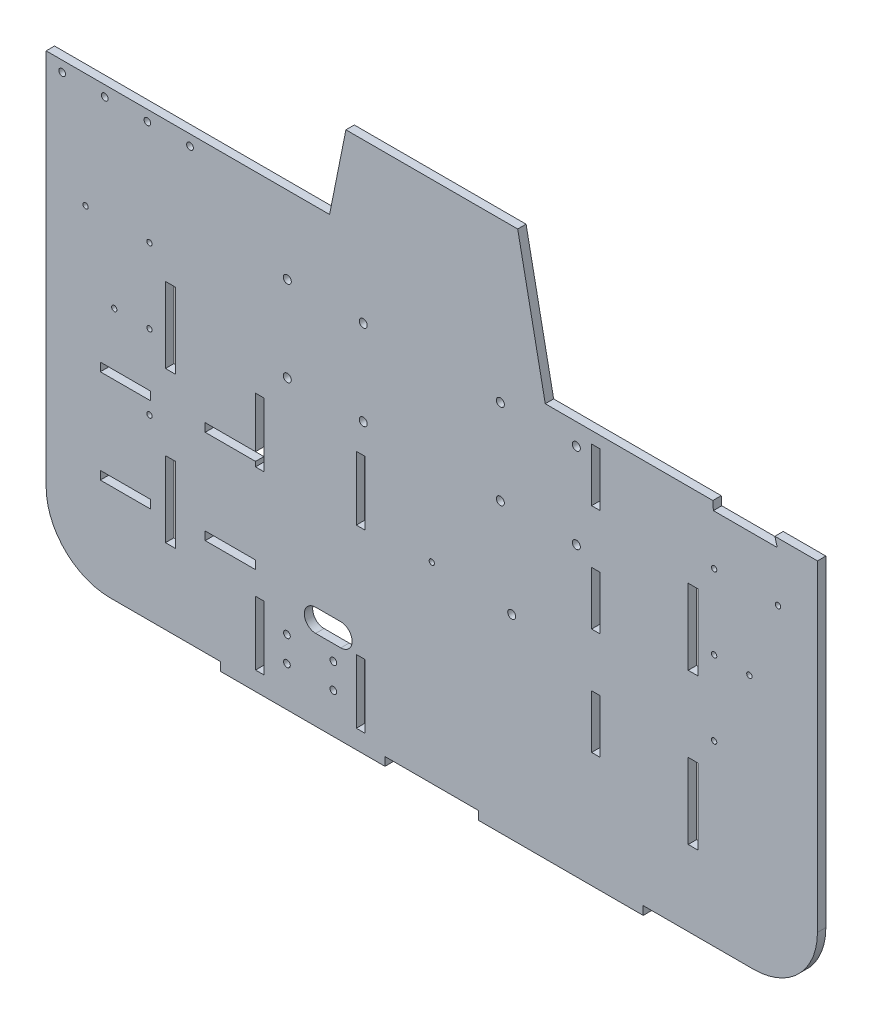
from build123d import *

# Parameters (mm, degrees)
SKETCH2_W           = 60
SKETCH2_H           = 10
SKETCH2_W_2         = 11.850089675
SKETCH2_H_2         = 89.916
SKETCH2_R           = 4
SKETCH2_W_3         = 10.16
SKETCH2_H_3         = 76.2
SKETCH2_R_2         = 3.175
SKETCH2_R_3         = 4.7625
SKETCH2_H_4         = 63.685061478
SKETCH2_H_5         = 63.685061479
BOSS_EXTRUDE1_DEPTH = 10


with BuildPart() as part:
    # Sketch2 → Boss-Extrude1 (new body)
    with BuildSketch(Plane.XY):
        with BuildLine():
            Line((-102.394461083, 316.728644457), (-121.859662508, 219.58578935))
            Line((-121.859662508, 219.58578935), (-459.721789204, 219.58578935))
            Line((-459.721789204, 219.58578935), (-459.721789204, -230.782639429))
            ThreePointArc((-459.721789204, -230.782639429), (-437.403325931, -284.664176156), (-383.521789204, -306.982639429))
            Line((-383.521789204, -306.982639429), (-252, -306.982639429))
            Line((-252, -306.982639429), (-252, -317.142639429))
            Line((-252, -317.142639429), (-55.8292, -317.142639429))
            Line((-55.8292, -317.142639429), (-55.8292, -306.982639429))
            Line((-55.8292, -306.982639429), (55.8292, -306.982639429))
            Line((55.8292, -306.982639429), (55.8292, -317.142639429))
            Line((55.8292, -317.142639429), (252, -317.142639429))
            Line((252, -317.142639429), (252, -306.982639429))
            Line((252, -306.982639429), (383.521789204, -306.982639429))
            ThreePointArc((383.521789204, -306.982639429), (437.403325931, -284.664176156), (459.721789204, -230.782639429))
            Line((459.721789204, -230.782639429), (459.721789204, 152.75736057))
            Line((459.721789204, 152.75736057), (408.921789204, 152.75736057))
            Line((408.921789204, 152.75736057), (411.84465756, 142.597360571))
            Line((411.84465756, 142.597360571), (335.64465756, 142.597360571))
            Line((335.64465756, 142.597360571), (335.022501884, 152.75736057))
            Line((335.022501884, 152.75736057), (135.250547773, 152.75736057))
            Line((135.250547773, 152.75736057), (102.394461083, 316.728644457))
            Line((102.394461083, 316.728644457), (-102.394461083, 316.728644457))
        make_face()
        with Locations((-365.16, -186.254154613)):
            Rectangle(SKETCH2_W, SKETCH2_H, mode=Mode.SUBTRACT)
        with Locations((-311.557332494, -172.10863943)):
            Rectangle(SKETCH2_W_2, SKETCH2_H_2, mode=Mode.SUBTRACT)
        with Locations((-240.16, -186.254154613)):
            Rectangle(SKETCH2_W, SKETCH2_H, mode=Mode.SUBTRACT)
        with Locations((-172.69, -269.442639429)):
            Circle(SKETCH2_R, mode=Mode.SUBTRACT)
        with Locations((-205.08, -256.782661115)):
            Rectangle(SKETCH2_W_3, SKETCH2_H_3, mode=Mode.SUBTRACT)
        with Locations((-172.69, -239.442639429)):
            Circle(SKETCH2_R, mode=Mode.SUBTRACT)
        with Locations((-117.38, -269.442639429)):
            Circle(SKETCH2_R, mode=Mode.SUBTRACT)
        with Locations((-117.38, -239.442639429)):
            Circle(SKETCH2_R, mode=Mode.SUBTRACT)
        with Locations((-84.92, -256.782661115)):
            Rectangle(SKETCH2_W_3, SKETCH2_H_3, mode=Mode.SUBTRACT)
        with BuildLine():
            ThreePointArc((-108.5, -194.170881029), (-95, -207.670881029), (-108.5, -221.170881029))
            Line((-108.5, -221.170881029), (-138.5, -221.170881029))
            ThreePointArc((-138.5, -221.170881029), (-152, -207.670881029), (-138.5, -194.170881029))
            Line((-138.5, -194.170881029), (-108.5, -194.170881029))
        make_face(mode=Mode.SUBTRACT)
        with Locations((-336.55027219, -94.687385458)):
            Circle(SKETCH2_R_2, mode=Mode.SUBTRACT)
        with Locations((-378.573819589, -5.78737531)):
            Circle(SKETCH2_R_2, mode=Mode.SUBTRACT)
        with Locations((-365.16, -74.446988355)):
            Rectangle(SKETCH2_W, SKETCH2_H, mode=Mode.SUBTRACT)
        Polygon((-270.16, -69.446988355), (-210.16, -69.446988355), (-210.16, -8.96237531), (-200, -8.96237531), (-200, -85.16237531), (-210.16, -85.16237531), (-210.16, -79.446988355), (-270.16, -79.446988355), align=None, mode=Mode.SUBTRACT)
        with Locations((-336.55027219, -5.787385458)):
            Circle(SKETCH2_R_2, mode=Mode.SUBTRACT)
        with Locations((-84.92, -47.06237531)):
            Rectangle(SKETCH2_W_3, SKETCH2_H_3, mode=Mode.SUBTRACT)
        with Locations((0, -78.38263943)):
            Circle(SKETCH2_R_2, mode=Mode.SUBTRACT)
        with Locations((311.557332494, -172.10863943)):
            Rectangle(SKETCH2_W_2, SKETCH2_H_2, mode=Mode.SUBTRACT)
        with Locations((95.25, -84.73263943)):
            Circle(SKETCH2_R_3, mode=Mode.SUBTRACT)
        with Locations((195.58, -147.752560311)):
            Rectangle(SKETCH2_W_3, SKETCH2_H_4, mode=Mode.SUBTRACT)
        with Locations((195.58, -20.382437355)):
            Rectangle(SKETCH2_W_3, SKETCH2_H_5, mode=Mode.SUBTRACT)
        with Locations((336.550272189, -94.687385458)):
            Circle(SKETCH2_R_2, mode=Mode.SUBTRACT)
        with Locations((336.550272189, -5.787385458)):
            Circle(SKETCH2_R_2, mode=Mode.SUBTRACT)
        with Locations((378.573819589, -5.78737531)):
            Circle(SKETCH2_R_2, mode=Mode.SUBTRACT)
        with Locations((-311.557332494, 7.72336057)):
            Rectangle(SKETCH2_W_2, SKETCH2_H_2, mode=Mode.SUBTRACT)
        with Locations((-412.75027219, 83.112614542)):
            Circle(SKETCH2_R_2, mode=Mode.SUBTRACT)
        with Locations((-336.55027219, 83.112614542)):
            Circle(SKETCH2_R_2, mode=Mode.SUBTRACT)
        with Locations((-172.2755, 25.75736057)):
            Circle(SKETCH2_R_3, mode=Mode.SUBTRACT)
        with Locations((-81.7245, 25.75736057)):
            Circle(SKETCH2_R_3, mode=Mode.SUBTRACT)
        with Locations((-172.2755, 127.35736057)):
            Circle(SKETCH2_R_3, mode=Mode.SUBTRACT)
        with Locations((-81.7245, 127.35736057)):
            Circle(SKETCH2_R_3, mode=Mode.SUBTRACT)
        with Locations((81.7245, 25.75736057)):
            Circle(SKETCH2_R_3, mode=Mode.SUBTRACT)
        with Locations((172.2755, 25.75736057)):
            Circle(SKETCH2_R_3, mode=Mode.SUBTRACT)
        with Locations((81.7245, 127.35736057)):
            Circle(SKETCH2_R_3, mode=Mode.SUBTRACT)
        with Locations((195.58, 106.97026018)):
            Rectangle(SKETCH2_W_3, SKETCH2_H_5, mode=Mode.SUBTRACT)
        with Locations((172.2755, 127.35736057)):
            Circle(SKETCH2_R_3, mode=Mode.SUBTRACT)
        with Locations((311.557332494, 7.72336057)):
            Rectangle(SKETCH2_W_2, SKETCH2_H_2, mode=Mode.SUBTRACT)
        with Locations((336.550272189, 83.112614542)):
            Circle(SKETCH2_R_2, mode=Mode.SUBTRACT)
        with Locations((412.750272189, 83.112614542)):
            Circle(SKETCH2_R_2, mode=Mode.SUBTRACT)
        with Locations((-339.071789204, 206.88578935)):
            Circle(SKETCH2_R, mode=Mode.SUBTRACT)
        with Locations((-288.271789204, 206.88578935)):
            Circle(SKETCH2_R, mode=Mode.SUBTRACT)
        with Locations((-440.671789204, 206.88578935)):
            Circle(SKETCH2_R, mode=Mode.SUBTRACT)
        with Locations((-389.871789204, 206.88578935)):
            Circle(SKETCH2_R, mode=Mode.SUBTRACT)
    extrude(amount=-BOSS_EXTRUDE1_DEPTH)


solid = part.part
